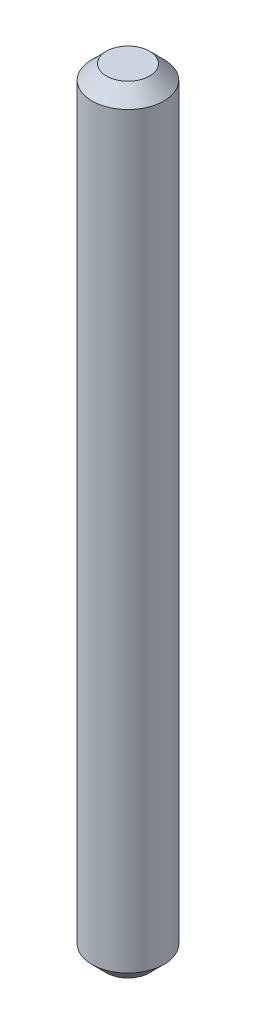
from build123d import *

# Parameters (mm, degrees)
SKETCH3_R           = 2.5
BOSS_EXTRUDE1_DEPTH = 54
CHAMFER2_SIZE       = 1


with BuildPart() as part:
    # Sketch3 → Boss-Extrude1 (new body)
    with BuildSketch(Plane(origin=(0, 0, 0), x_dir=(1, 0, 0), z_dir=(0, 1, 0))):
        with Locations(Location((0, 0, 0), (0, 0, 270))):
            Circle(SKETCH3_R)
    extrude(amount=BOSS_EXTRUDE1_DEPTH)

    # Chamfer2
    chamfer2_edges = [part.edges().sort_by_distance(p)[0] for p in [
        (0, 0, -2.5),
        (0, 54, -2.5),
    ]]
    chamfer(chamfer2_edges, length=CHAMFER2_SIZE)


solid = part.part
